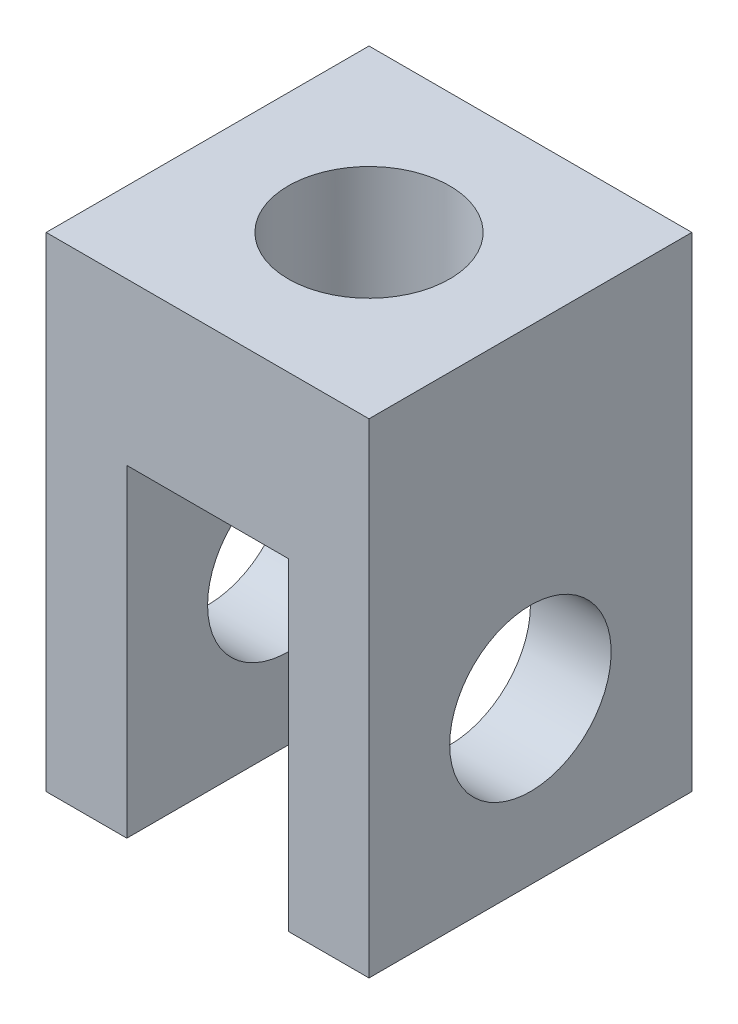
from build123d import *

# Parameters (mm, degrees)
SKETCH_1_W          = 20
SKETCH_1_H          = 20
EXTRUDE_1_DEPTH     = 10
SKETCH_2_R          = 5
CUT_EXTRUDE_2_DEPTH = 18.320508076
SKETCH_3_W          = 5
SKETCH_3_H          = 20
EXTRUDE_2_DEPTH     = 20
SKETCH_4_R          = 5
CUT_EXTRUDE_3_DEPTH = 31


with BuildPart() as part:
    # 草图1 → 凸台-拉伸1 (new body)
    with BuildSketch(Plane(origin=(0, 0, 0), x_dir=(1, 0, 0), z_dir=(0, 1, 0))):
        Rectangle(SKETCH_1_W, SKETCH_1_H)
    extrude(amount=EXTRUDE_1_DEPTH)

    # 草图2 → 切除-拉伸2 (cut, through all)
    with BuildSketch(Plane(origin=(0, 10, 0), x_dir=(1, 0, 0), z_dir=(0, 1, 0))):
        with Locations(Location((0, 0, 0), (0, 0, 270))):
            Circle(SKETCH_2_R)
    extrude(amount=-CUT_EXTRUDE_2_DEPTH, mode=Mode.SUBTRACT)

    # 草图3 → 凸台-拉伸2 (add)
    with BuildSketch(Plane.XZ):
        with Locations((-7.5, 0)):
            Rectangle(SKETCH_3_W, SKETCH_3_H)
        with Locations((7.5, 0)):
            Rectangle(SKETCH_3_W, SKETCH_3_H)
    extrude(amount=EXTRUDE_2_DEPTH)

    # 草图4 → 切除-拉伸3 (cut, through all)
    with BuildSketch(Plane.ZY.offset(10)):
        with Locations((0, -10)):
            Circle(SKETCH_4_R)
    extrude(amount=-CUT_EXTRUDE_3_DEPTH, mode=Mode.SUBTRACT)


solid = part.part
